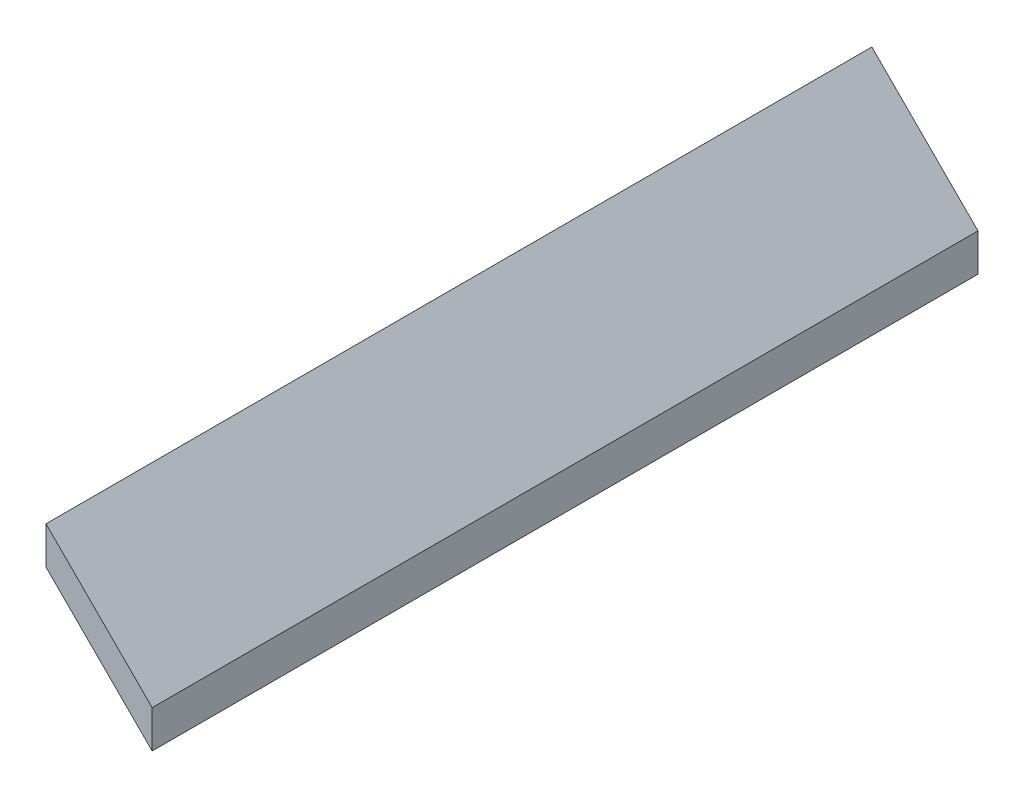
from build123d import *

# Parameters (mm, degrees)
BOSS_EXTRUDE1_DEPTH = 279.4


with BuildPart() as part:
    # Sketch1 → Boss-Extrude1 (new body)
    with BuildSketch(Plane.XY):
        Polygon((0, 0), (0, 12.7), (-35.921024484, 48.621024484), (-35.921024484, 35.921024484), align=None)
    extrude(amount=BOSS_EXTRUDE1_DEPTH)


solid = part.part
